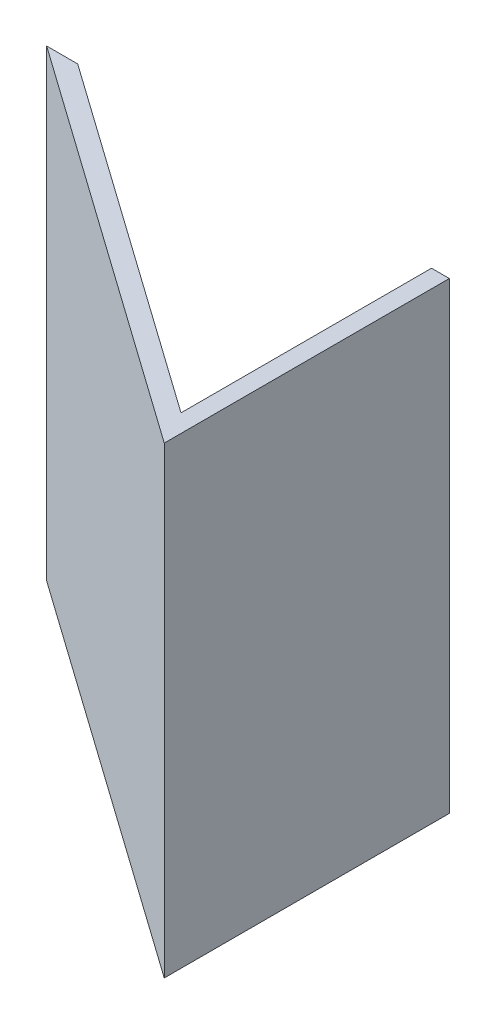
from build123d import *

# Parameters (mm, degrees)
BOSS_EXTRUDE1_DEPTH = 82.55


with BuildPart() as part:
    # Sketch1 → Boss-Extrude1 (new body)
    with BuildSketch(Plane(origin=(0, 0, 0), x_dir=(1, 0, 0), z_dir=(0, 1, 0))):
        Polygon((65.027116768, 34.190845126), (65.027116768, -16.609154874), (-6.727883232, 34.190845126), (-1.200843232, 34.190845126), (61.852116768, -10.449654874), (61.852116768, 34.190845126), align=None)
    extrude(amount=BOSS_EXTRUDE1_DEPTH)


solid = part.part
